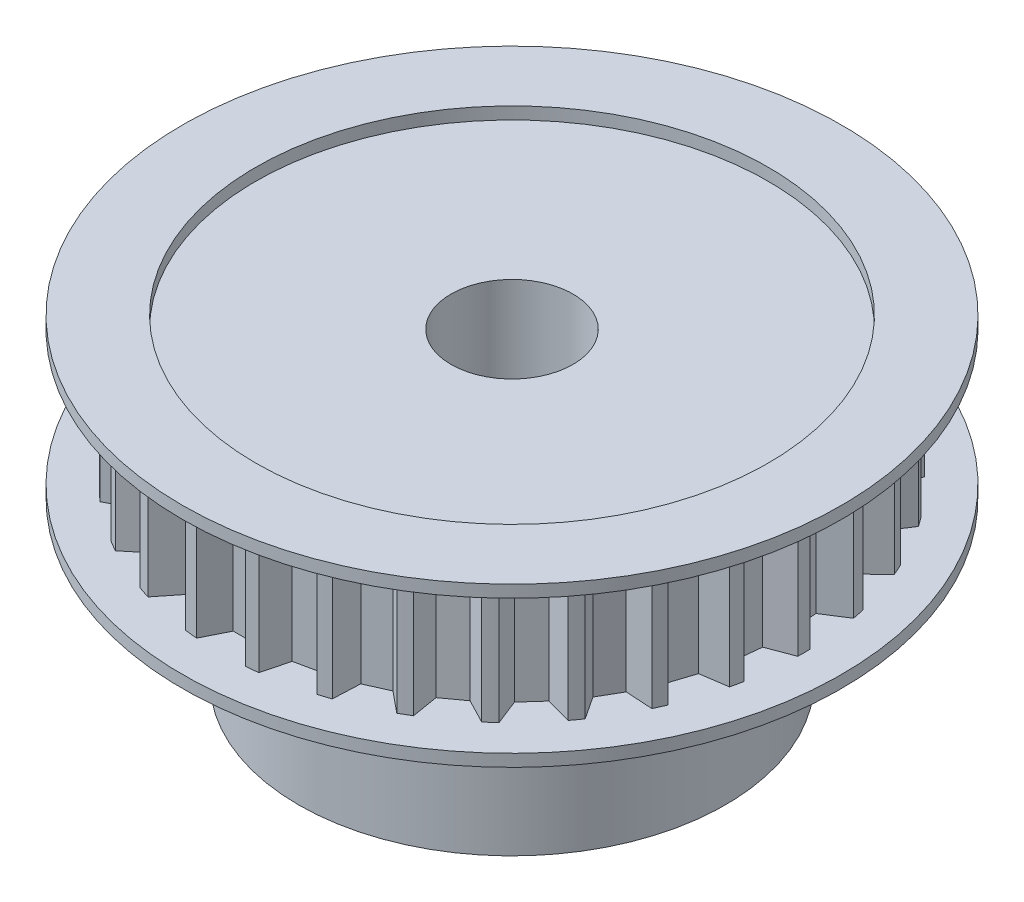
from build123d import *

# Parameters (mm, degrees)
SKETCH1_R           = 23.925
SKETCH1_R_2         = 5
BOSS_EXTRUDE1_DEPTH = 5.5
SKETCH2_R           = 17.5
SKETCH2_R_2         = 4
BOSS_EXTRUDE3_DEPTH = 14
CUT_EXTRUDE1_DEPTH  = 11
CIRPATTERN10_COUNT  = 30
SKETCH4_R           = 27
SKETCH4_R_2         = 21
BOSS_EXTRUDE4_DEPTH = 1
BOSS_EXTRUDE5_START = 1
SKETCH5_R           = 27
SKETCH5_R_2         = 21
BOSS_EXTRUDE5_DEPTH = 1


with BuildPart() as part:
    # Sketch1 → Boss-Extrude1 (new, symmetric)
    with BuildSketch(Plane(origin=(0, 0, 0), x_dir=(1, 0, 0), z_dir=(0, 1, 0))):
        with Locations(Location((0, 0, 0), (0, 0, 270))):
            Circle(SKETCH1_R)
        with Locations(Location((0, 0, 0), (0, 0, 270))):
            Circle(SKETCH1_R_2, mode=Mode.SUBTRACT)
    extrude(amount=BOSS_EXTRUDE1_DEPTH, both=True)

    # Sketch2 → Boss-Extrude3 (add)
    with BuildSketch(Plane.XZ.offset(5.5)):
        with Locations(Location((0, 0, 0), (0, 0, 270))):
            Circle(SKETCH2_R)
        with Locations(Location((0, 0, 0), (0, 0, 270))):
            Circle(SKETCH2_R_2, mode=Mode.SUBTRACT)
    extrude(amount=BOSS_EXTRUDE3_DEPTH)

    # Sketch3 → Cut-Extrude1 (cut)
    with BuildSketch(Plane(origin=(0, 5.5, 0), x_dir=(1, 0, 0), z_dir=(0, 1, 0))):
        Polygon((-1, 21.84125888), (1, 21.84125888), (2, 23.84125888), (2.094207699, 23.965937646), (-2.062339383, 23.965937646), (-2, 23.84125888), align=None)
    cut_extrude1 = extrude(amount=-CUT_EXTRUDE1_DEPTH, mode=Mode.SUBTRACT)

    # CirPattern10: Cut-Extrude1 ×30 about axis
    cirpattern10_axis = Axis((0, 0, 0), (0, 1, 0))
    for i in range(1, CIRPATTERN10_COUNT):
        add(cut_extrude1.rotate(cirpattern10_axis, i * 360 / CIRPATTERN10_COUNT), mode=Mode.SUBTRACT)

    # Sketch4 → Boss-Extrude4 (add)
    with BuildSketch(Plane(origin=(0, 5.5, 0), x_dir=(1, 0, 0), z_dir=(0, 1, 0))):
        with Locations(Location((0, 0, 0), (0, 0, 270))):
            Circle(SKETCH4_R)
        with Locations(Location((0, 0, 0), (0, 0, 270))):
            Circle(SKETCH4_R_2, mode=Mode.SUBTRACT)
    extrude(amount=BOSS_EXTRUDE4_DEPTH)

    # Sketch5 → Boss-Extrude5 (add)
    with BuildSketch(Plane.XZ.offset(5.5).offset(BOSS_EXTRUDE5_START)):
        with Locations(Location((0, 0, 0), (0, 0, 90))):
            Circle(SKETCH5_R)
        with Locations(Location((0, 0, 0), (0, 0, 90))):
            Circle(SKETCH5_R_2, mode=Mode.SUBTRACT)
    extrude(amount=-BOSS_EXTRUDE5_DEPTH)


solid = part.part
